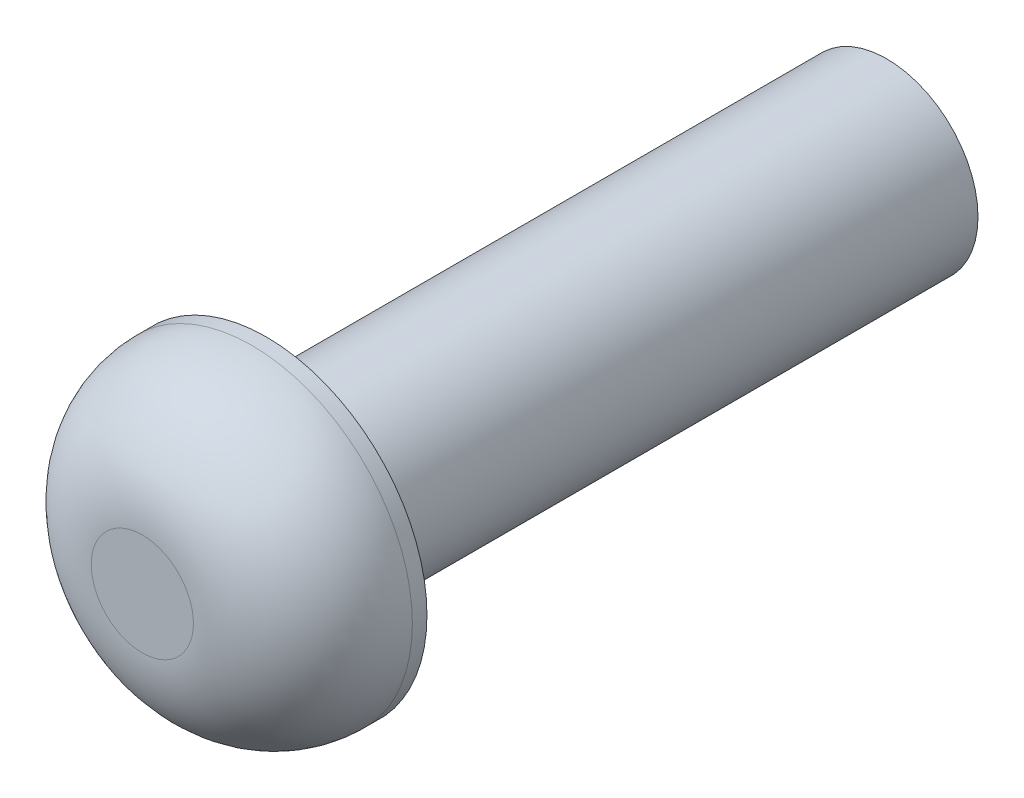
from build123d import *

# Parameters (mm, degrees)
SKETCH_1_R      = 2.5
EXTRUDE_1_DEPTH = 17
SKETCH_2_R      = 4.4
EXTRUDE_2_DEPTH = 3.4
FILLET_1_R      = 3


with BuildPart() as part:
    # 草图1 → 凸台-拉伸1 (new body)
    with BuildSketch(Plane.XY):
        Circle(SKETCH_1_R)
    extrude(amount=EXTRUDE_1_DEPTH)

    # 草图2 → 凸台-拉伸2 (add)
    with BuildSketch(Plane.XY.offset(17)):
        Circle(SKETCH_2_R)
    extrude(amount=EXTRUDE_2_DEPTH)

    # 圆角1
    fillet_1_edges = [part.edges().sort_by_distance(p)[0] for p in [
        (-4.4, 0, 20.4),
    ]]
    fillet(fillet_1_edges, radius=FILLET_1_R)


solid = part.part
